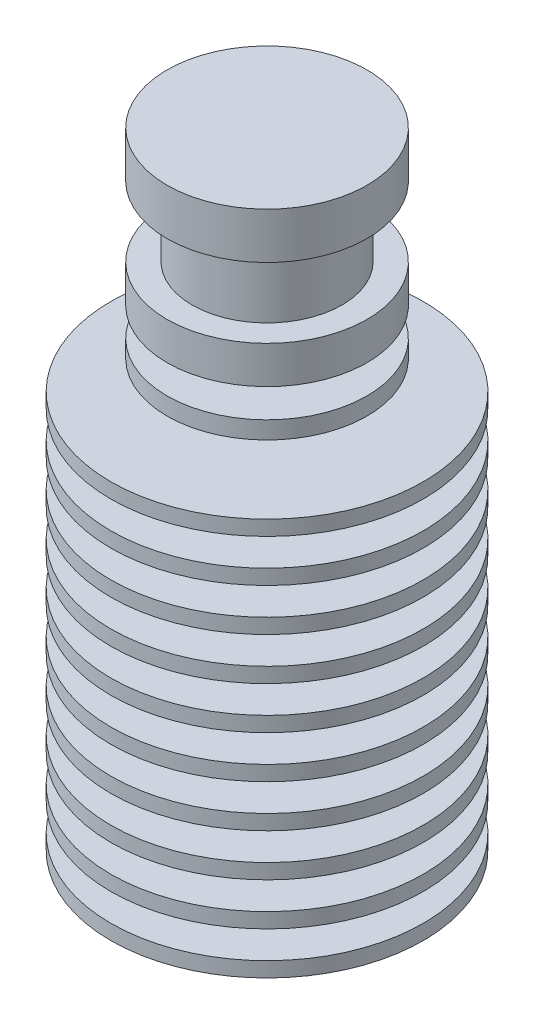
from build123d import *

# Parameters (mm, degrees)
SKETCH2_W           = 8
SKETCH2_H           = 2.2
LPATTERN1_COUNT     = 9
LPATTERN1_PITCH     = 3.4
BOSS_EXTRUDE1_REACH = 55.127
SKETCH3_R           = 7.5
SKETCH4_R           = 6
BOSS_EXTRUDE2_DEPTH = 2.2


with BuildPart() as part:
    # Sketch1 → Revolve1 (revolve)
    with BuildSketch(Plane.XY, mode=Mode.PRIVATE) as revolve1_sk:
        Polygon((0, 0), (8, 0), (8, -3.7), (6, -3.7), (6, -9.3), (8, -9.3), (8, -12.3), (4.5, -12.3), (4.5, -14.6), (8, -14.6), (8, -16), (4.5, -16), (4.5, -18.3), (12.5, -18.3), (12.5, -50.1), (0, -50.1), align=None)
    revolve(revolve1_sk.sketch.rotate(Axis((0, 0, 0), (0, -1, 0)), 90), axis=Axis((0, 0, 0), (0, -1, 0)))

    # Sketch2 → Cut-Revolve3 (revolve, cut)
    with BuildSketch(Plane.XY, mode=Mode.PRIVATE) as cut_revolve3_sk:
        with Locations((8.5, -47.8)):
            Rectangle(SKETCH2_W, SKETCH2_H)
    cut_revolve3 = revolve(cut_revolve3_sk.sketch.rotate(Axis((0, 0, 0), (0, -1, 0)), 90), axis=Axis((0, 0, 0), (0, -1, 0)), mode=Mode.SUBTRACT)

    # LPattern1: Cut-Revolve3 ×9
    with Locations(*[(0, i * LPATTERN1_PITCH, 0) for i in range(1, LPATTERN1_COUNT)]):
        add(cut_revolve3, mode=Mode.SUBTRACT)

    # Boss-Extrude1: up to this face of the body (flat: up to its plane)
    boss_extrude1_end = Plane(part.part.faces().sort_by_distance((0, -31.9, -4.853553391))[0])
    # Sketch3 → Boss-Extrude1 (add, up to the picked face)
    with BuildSketch(Plane.XZ.offset(50.1), mode=Mode.PRIVATE) as boss_extrude1_sk1:
        with Locations(Location((0, 0, 0), (0, 0, 270))):
            Circle(SKETCH3_R)
    boss_extrude1_tool1 = split(extrude(boss_extrude1_sk1.sketch, amount=-BOSS_EXTRUDE1_REACH, mode=Mode.PRIVATE), bisect_by=boss_extrude1_end, keep=Keep.BOTH, mode=Mode.PRIVATE)
    add(boss_extrude1_tool1.solids().sort_by(Axis((0, -50.1, 0), (0, 1, 0)))[0])

    # Sketch4 → Boss-Extrude2 (add)
    with BuildSketch(Plane(origin=(0, -31.9, 0), x_dir=(1, 0, 0), z_dir=(0, 1, 0))):
        with Locations(Location((0, 0, 0), (0, 0, 270))):
            Circle(SKETCH4_R)
    extrude(amount=BOSS_EXTRUDE2_DEPTH)


solid = part.part
